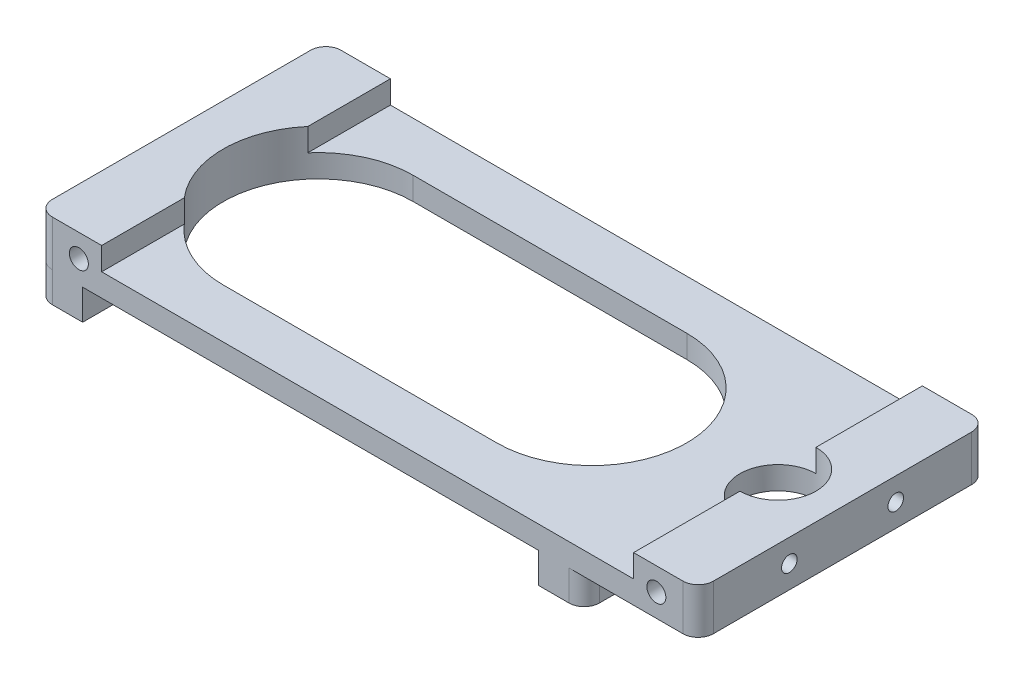
from build123d import *

# Parameters (mm, degrees)
BOSS_EXTRUDE1_DEPTH          = 38
FILLET3_R                    = 2
CUT_EXTRUDE1_DEPTH           = 98.450613347
CUT_EXTRUDE1_DEPTH_BACK      = 98.450613347
M3X0_5_TAPPED_HOLE3_D        = 2.5
M3X0_5_TAPPED_HOLE3_DEPTH    = 7.5
M3X0_5_TAPPED_HOLE3_TIP      = 0.751075774
M3X0_5_TAPPED_HOLE4_D        = 2.5
M3X0_5_TAPPED_HOLE4_DEPTH    = 7.5
M3X0_5_TAPPED_HOLE4_TIP      = 0.751075774
M2_5X0_45_TAPPED_HOLE1_D     = 2.05
M2_5X0_45_TAPPED_HOLE1_DEPTH = 6.35
M2_5X0_45_TAPPED_HOLE1_TIP   = 0.615882135
M2_5X0_45_TAPPED_HOLE2_D     = 2.05
M2_5X0_45_TAPPED_HOLE2_DEPTH = 6.35
M2_5X0_45_TAPPED_HOLE2_TIP   = 0.615882135
SKETCH14_R                   = 5
CUT_EXTRUDE2_DEPTH           = 98.58904673
SKETCH16_W                   = 6
SKETCH16_H                   = 6
BOSS_EXTRUDE2_DEPTH          = 4
FILLET4_R                    = 2
M3X0_5_TAPPED_HOLE5_D        = 2.5
M3X0_5_TAPPED_HOLE5_DEPTH    = 5.5
M3X0_5_TAPPED_HOLE5_TIP      = 0.751075774


with BuildPart() as part:
    # Sketch2 → Boss-Extrude1 (new body)
    with BuildSketch(Plane.XY.offset(11.2)):
        Polygon((-84.06534388, 85.95185693), (-75.56534388, 85.95185693), (-75.56534388, 82.95185693), (-5.56534388, 82.95185693), (-5.56534388, 85.95185693), (2.93465612, 85.95185693), (2.93465612, 79.95185693), (-84.06534388, 79.95185693), align=None)
    extrude(amount=BOSS_EXTRUDE1_DEPTH)

    # Fillet3
    fillet3_edges = [part.edges().sort_by_distance(p)[0] for p in [
        (2.93465612, 82.95185693, 49.2),
        (-84.06534388, 82.95185693, 11.2),
        (-84.06534388, 82.95185693, 49.2),
        (2.93465612, 82.95185693, 11.2),
    ]]
    fillet(fillet3_edges, radius=FILLET3_R)

    # Sketch3 → Cut-Extrude1 (cut, two sides: drawn at the far end of the back side and taken through both)
    with BuildSketch(Plane(origin=(0, 82.95185693, 0), x_dir=(1, 0, 0), z_dir=(0, 1, 0)).offset(-CUT_EXTRUDE1_DEPTH_BACK)):
        with BuildLine():
            Line((-66.06534388, -42.7), (-30.06534388, -42.7))
            ThreePointArc((-30.06534388, -42.7), (-17.56534388, -30.2), (-30.06534388, -17.7))
            Line((-30.06534388, -17.7), (-66.06534388, -17.7))
            ThreePointArc((-66.06534388, -17.7), (-78.56534388, -30.2), (-66.06534388, -42.7))
        make_face()
    extrude(amount=CUT_EXTRUDE1_DEPTH + CUT_EXTRUDE1_DEPTH_BACK, mode=Mode.SUBTRACT)

    # M3x0.5 Tapped Hole3
    with Locations(Plane.XY.offset(49.2)):
        with Locations((-78.56534388, 82.95185693), (-2.56534388, 82.95185693)):
            Hole(M3X0_5_TAPPED_HOLE3_D / 2, depth=M3X0_5_TAPPED_HOLE3_DEPTH)
            with Locations((0, 0, -(M3X0_5_TAPPED_HOLE3_DEPTH + M3X0_5_TAPPED_HOLE3_TIP / 2))):  # 118° drill point
                Cone(0, M3X0_5_TAPPED_HOLE3_D / 2, M3X0_5_TAPPED_HOLE3_TIP, mode=Mode.SUBTRACT)

    # M3x0.5 Tapped Hole4
    with Locations(Plane(origin=(0, 0, 11.2), x_dir=(-1, 0, 0), z_dir=(0, 0, -1))):
        with Locations((2.56534388, 82.95185693), (78.56534388, 82.95185693)):
            Hole(M3X0_5_TAPPED_HOLE4_D / 2, depth=M3X0_5_TAPPED_HOLE4_DEPTH)
            with Locations((0, 0, -(M3X0_5_TAPPED_HOLE4_DEPTH + M3X0_5_TAPPED_HOLE4_TIP / 2))):  # 118° drill point
                Cone(0, M3X0_5_TAPPED_HOLE4_D / 2, M3X0_5_TAPPED_HOLE4_TIP, mode=Mode.SUBTRACT)

    # M2.5x0.45 Tapped Hole1
    with Locations(Plane.ZY.offset(84.06534388)):
        with Locations((23.2, 82.95185693), (37.2, 82.95185693)):
            Hole(M2_5X0_45_TAPPED_HOLE1_D / 2, depth=M2_5X0_45_TAPPED_HOLE1_DEPTH)
            with Locations((0, 0, -(M2_5X0_45_TAPPED_HOLE1_DEPTH + M2_5X0_45_TAPPED_HOLE1_TIP / 2))):  # 118° drill point
                Cone(0, M2_5X0_45_TAPPED_HOLE1_D / 2, M2_5X0_45_TAPPED_HOLE1_TIP, mode=Mode.SUBTRACT)

    # M2.5x0.45 Tapped Hole2
    with Locations(Plane(origin=(2.93465612, 0, 0), x_dir=(0, 0, -1), z_dir=(1, 0, 0))):
        with Locations((-37.2, 82.95185693), (-23.2, 82.95185693)):
            Hole(M2_5X0_45_TAPPED_HOLE2_D / 2, depth=M2_5X0_45_TAPPED_HOLE2_DEPTH)
            with Locations((0, 0, -(M2_5X0_45_TAPPED_HOLE2_DEPTH + M2_5X0_45_TAPPED_HOLE2_TIP / 2))):  # 118° drill point
                Cone(0, M2_5X0_45_TAPPED_HOLE2_D / 2, M2_5X0_45_TAPPED_HOLE2_TIP, mode=Mode.SUBTRACT)

    # Sketch14 → Cut-Extrude2 (cut, through all)
    with BuildSketch(Plane(origin=(0, 85.95185693, 0), x_dir=(1, 0, 0), z_dir=(0, 1, 0))):
        with Locations(Location((-5.56534388, -30.2, 0), (0, 0, 270))):
            Circle(SKETCH14_R)
    extrude(amount=-CUT_EXTRUDE2_DEPTH, mode=Mode.SUBTRACT)

    # Sketch16 → Boss-Extrude2 (add)
    with BuildSketch(Plane.XZ.offset(-79.95185693)):
        with Locations((-81.06534388, 46.2)):
            Rectangle(SKETCH16_W, SKETCH16_H)
        with Locations((-81.06534388, 14.2)):
            Rectangle(SKETCH16_W, SKETCH16_H)
        with Locations((-15.06534388, 46.2)):
            Rectangle(SKETCH16_W, SKETCH16_H)
        with Locations((-15.06534388, 14.2)):
            Rectangle(SKETCH16_W, SKETCH16_H)
    extrude(amount=BOSS_EXTRUDE2_DEPTH)

    # Fillet4
    fillet4_edges = [part.edges().sort_by_distance(p)[0] for p in [
        (-12.06534388, 77.95185693, 49.2),
        (-12.06534388, 77.95185693, 11.2),
        (-84.06534388, 77.95185693, 11.2),
        (-84.06534388, 77.95185693, 49.2),
        (-78.06534388, 77.95185693, 43.2),
        (-78.06534388, 77.95185693, 17.2),
        (-18.06534388, 77.95185693, 17.2),
        (-18.06534388, 77.95185693, 43.2),
    ]]
    fillet(fillet4_edges, radius=FILLET4_R)

    # M3x0.5 Tapped Hole5
    with Locations(Plane.XZ.offset(-75.95185693)):
        with Locations((-81.06534388, 46.2), (-81.06534388, 14.2), (-15.06534388, 14.2), (-15.06534388, 46.2)):
            Hole(M3X0_5_TAPPED_HOLE5_D / 2, depth=M3X0_5_TAPPED_HOLE5_DEPTH)
            with Locations((0, 0, -(M3X0_5_TAPPED_HOLE5_DEPTH + M3X0_5_TAPPED_HOLE5_TIP / 2))):  # 118° drill point
                Cone(0, M3X0_5_TAPPED_HOLE5_D / 2, M3X0_5_TAPPED_HOLE5_TIP, mode=Mode.SUBTRACT)


solid = part.part
